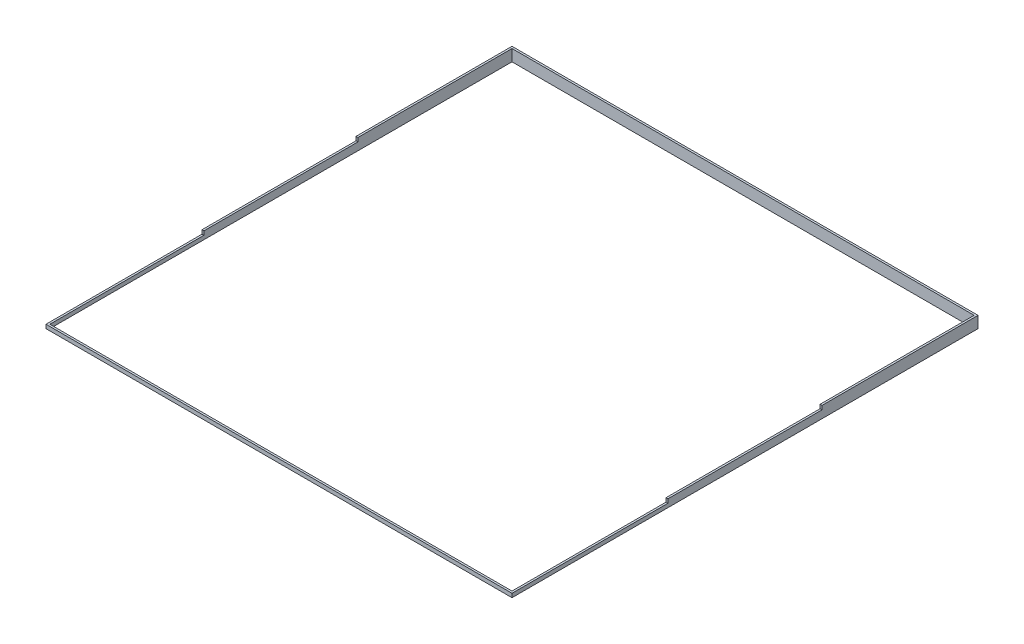
from build123d import *

# Parameters (mm, degrees)
SKETCH2_W           = 12100
SKETCH2_H           = 12100
BOSS_EXTRUDE2_DEPTH = 300
SKETCH3_W           = 12000
SKETCH3_H           = 12000
CUT_EXTRUDE1_DEPTH  = 301
SKETCH5_W           = 50
SKETCH5_H           = 4000
CUT_EXTRUDE2_DEPTH  = 200
SKETCH6_W           = 50
SKETCH6_H           = 4000
CUT_EXTRUDE3_DEPTH  = 100
SKETCH7_W           = 50
SKETCH7_H           = 4000
CUT_EXTRUDE4_DEPTH  = 200
SKETCH8_W           = 50
SKETCH8_H           = 4000
CUT_EXTRUDE5_DEPTH  = 100
SKETCH10_W          = 12100
SKETCH10_H          = 50
CUT_EXTRUDE6_DEPTH  = 200


with BuildPart() as part:
    # Sketch2 → Boss-Extrude2 (new body)
    with BuildSketch(Plane(origin=(0, 0, 0), x_dir=(1, 0, 0), z_dir=(0, 1, 0))):
        Rectangle(SKETCH2_W, SKETCH2_H)
    extrude(amount=BOSS_EXTRUDE2_DEPTH)

    # Sketch3 → Cut-Extrude1 (cut)
    with BuildSketch(Plane(origin=(0, 300, 0), x_dir=(1, 0, 0), z_dir=(0, 1, 0))):
        Rectangle(SKETCH3_W, SKETCH3_H)
    extrude(amount=-CUT_EXTRUDE1_DEPTH, mode=Mode.SUBTRACT)

    # Sketch5 → Cut-Extrude2 (cut)
    with BuildSketch(Plane(origin=(0, 300, 0), x_dir=(1, 0, 0), z_dir=(0, 1, 0))):
        with Locations((-6025, -4000)):
            Rectangle(SKETCH5_W, SKETCH5_H)
    extrude(amount=-CUT_EXTRUDE2_DEPTH, mode=Mode.SUBTRACT)

    # Sketch6 → Cut-Extrude3 (cut)
    with BuildSketch(Plane(origin=(0, 300, 0), x_dir=(1, 0, 0), z_dir=(0, 1, 0))):
        with Locations((-6025, 0)):
            Rectangle(SKETCH6_W, SKETCH6_H)
    extrude(amount=-CUT_EXTRUDE3_DEPTH, mode=Mode.SUBTRACT)

    # Sketch7 → Cut-Extrude4 (cut)
    with BuildSketch(Plane(origin=(0, 300, 0), x_dir=(1, 0, 0), z_dir=(0, 1, 0))):
        with Locations((6025, -4000)):
            Rectangle(SKETCH7_W, SKETCH7_H)
    extrude(amount=-CUT_EXTRUDE4_DEPTH, mode=Mode.SUBTRACT)

    # Sketch8 → Cut-Extrude5 (cut)
    with BuildSketch(Plane(origin=(0, 300, 0), x_dir=(1, 0, 0), z_dir=(0, 1, 0))):
        with Locations((6025, 0)):
            Rectangle(SKETCH8_W, SKETCH8_H)
    extrude(amount=-CUT_EXTRUDE5_DEPTH, mode=Mode.SUBTRACT)

    # Sketch10 → Cut-Extrude6 (cut)
    with BuildSketch(Plane(origin=(0, 300, 0), x_dir=(1, 0, 0), z_dir=(0, 1, 0))):
        with Locations((0, -6025)):
            Rectangle(SKETCH10_W, SKETCH10_H)
    extrude(amount=-CUT_EXTRUDE6_DEPTH, mode=Mode.SUBTRACT)


solid = part.part
